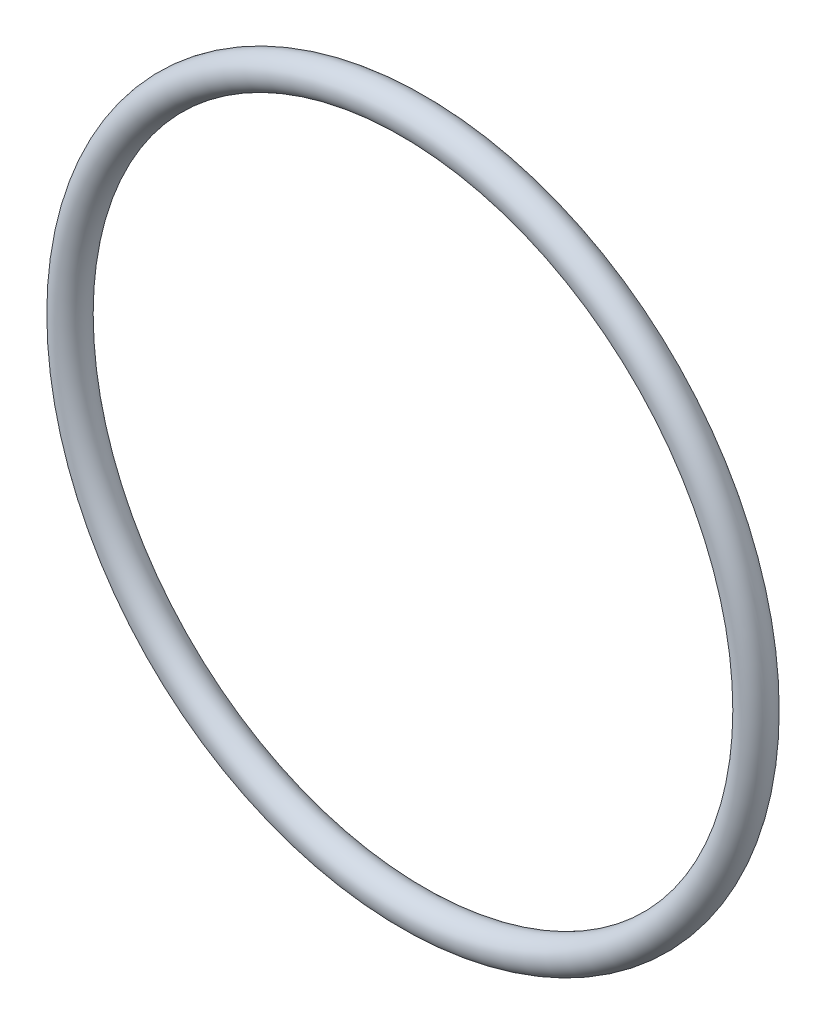
from build123d import *

# Parameters (mm, degrees)
SKETCH2_R = 1.3081


with BuildPart() as part:
    # Sketch2 → Revolve1 (revolve)
    with BuildSketch(Plane(origin=(0, 0, 0), x_dir=(1, 0, 0), z_dir=(0, 1, 0)), mode=Mode.PRIVATE) as revolve1_sk:
        with Locations((-27.3431, 0)):
            Circle(SKETCH2_R)
    revolve(revolve1_sk.sketch.rotate(Axis((0, 0, 1.3081), (0, 0, -1)), 180), axis=Axis((0, 0, 1.3081), (0, 0, -1)))


solid = part.part
